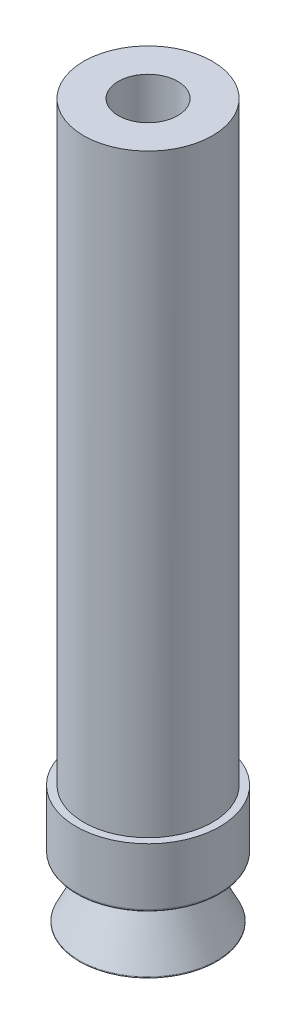
from build123d import *

# Parameters (mm, degrees)
SKETCH1_R           = 6.5
BOSS_EXTRUDE1_DEPTH = 60
SKETCH2_R           = 3
INNER_CHAMBER_DEPTH = 52.5
SKETCH4_R           = 7.25
BOSS_EXTRUDE2_DEPTH = 6
FILLET4_R           = 0.1
FILLET5_R           = 0.25
FILLET6_R           = 0.25


with BuildPart() as part:
    # Sketch1 → Boss-Extrude1 (new body)
    with BuildSketch(Plane(origin=(0, 0, 0), x_dir=(1, 0, 0), z_dir=(0, 1, 0))):
        with Locations(Location((0, 0, 0), (0, 0, 270))):
            Circle(SKETCH1_R)
    extrude(amount=BOSS_EXTRUDE1_DEPTH)

    # Sketch2 → Inner Chamber (cut)
    with BuildSketch(Plane(origin=(0, 60, 0), x_dir=(1, 0, 0), z_dir=(0, 1, 0))):
        with Locations(Location((0, 0, 0), (0, 0, 270))):
            Circle(SKETCH2_R)
    extrude(amount=-INNER_CHAMBER_DEPTH, mode=Mode.SUBTRACT)

    # Sketch4 → Boss-Extrude2 (add)
    with BuildSketch(Plane.XZ):
        with Locations(Location((0, 0, 0), (0, 0, 270))):
            Circle(SKETCH4_R)
    extrude(amount=BOSS_EXTRUDE2_DEPTH)

    # Sketch6 → Revolve1 (revolve)
    with BuildSketch(Plane(origin=(0, 0, 0), x_dir=(0, 0, -1), z_dir=(1, 0, 0))):
        Polygon((1, -6), (6.75, -12), (7, -12), (4, -6), align=None)
    revolve(axis=Axis((0, -6, 0), (0, -1, 0)))

    # Fillet4
    fillet4_edges = [part.edges().sort_by_distance(p)[0] for p in [
        (0, -12, 7),
        (0, -12, 6.75),
    ]]
    fillet(fillet4_edges, radius=FILLET4_R)

    # Fillet5
    fillet5_edges = [part.edges().sort_by_distance(p)[0] for p in [
        (0, -6, 7.25),
    ]]
    fillet(fillet5_edges, radius=FILLET5_R)

    # Fillet6
    fillet6_edges = [part.edges().sort_by_distance(p)[0] for p in [
        (0, -6, 4),
    ]]
    fillet(fillet6_edges, radius=FILLET6_R)


solid = part.part
